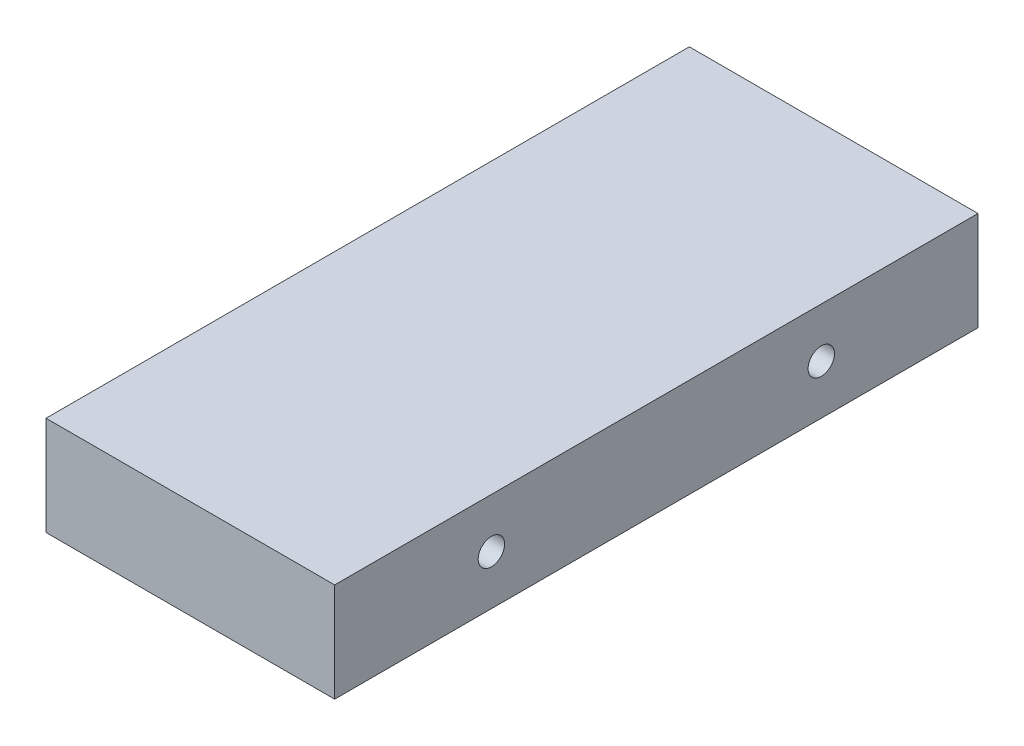
from build123d import *

# Parameters (mm, degrees)
SKETCH1_W           = 78
SKETCH1_H           = 12
BOSS_EXTRUDE1_DEPTH = 35
SKETCH1_4_R         = 4
CUT_EXTRUDE1_DEPTH  = 27
SKETCH1_5_R         = 1.6
CUT_EXTRUDE2_DEPTH  = 35
SKETCH1_6_R         = 1.621
CUT_EXTRUDE3_DEPTH  = 12


with BuildPart() as part:
    # Sketch1 → Boss-Extrude1 (new body)
    with BuildSketch(Plane(origin=(0, 0, 0), x_dir=(0, 0, -1), z_dir=(1, 0, 0))):
        Rectangle(SKETCH1_W, SKETCH1_H)
    extrude(amount=BOSS_EXTRUDE1_DEPTH)

    # Sketch1<4> → Cut-Extrude1 (cut)
    with BuildSketch(Plane(origin=(0, 0, 0), x_dir=(0, 0, -1), z_dir=(1, 0, 0))):
        with Locations((-20, 0)):
            Circle(SKETCH1_4_R)
        with Locations((20, 0)):
            Circle(SKETCH1_4_R)
    extrude(amount=CUT_EXTRUDE1_DEPTH, mode=Mode.SUBTRACT)

    # Sketch1<5> → Cut-Extrude2 (cut)
    with BuildSketch(Plane(origin=(0, 0, 0), x_dir=(0, 0, -1), z_dir=(1, 0, 0))):
        with Locations((-20, 0)):
            Circle(SKETCH1_5_R)
        with Locations((20, 0)):
            Circle(SKETCH1_5_R)
    extrude(amount=CUT_EXTRUDE2_DEPTH, mode=Mode.SUBTRACT)

    # Sketch1<6> → Cut-Extrude3 (cut)
    with BuildSketch(Plane(origin=(0, 0, 0), x_dir=(0, 0, -1), z_dir=(1, 0, 0))):
        with Locations((-34, 0)):
            Circle(SKETCH1_6_R)
        with Locations((34, 0)):
            Circle(SKETCH1_6_R)
    extrude(amount=CUT_EXTRUDE3_DEPTH, mode=Mode.SUBTRACT)


solid = part.part
